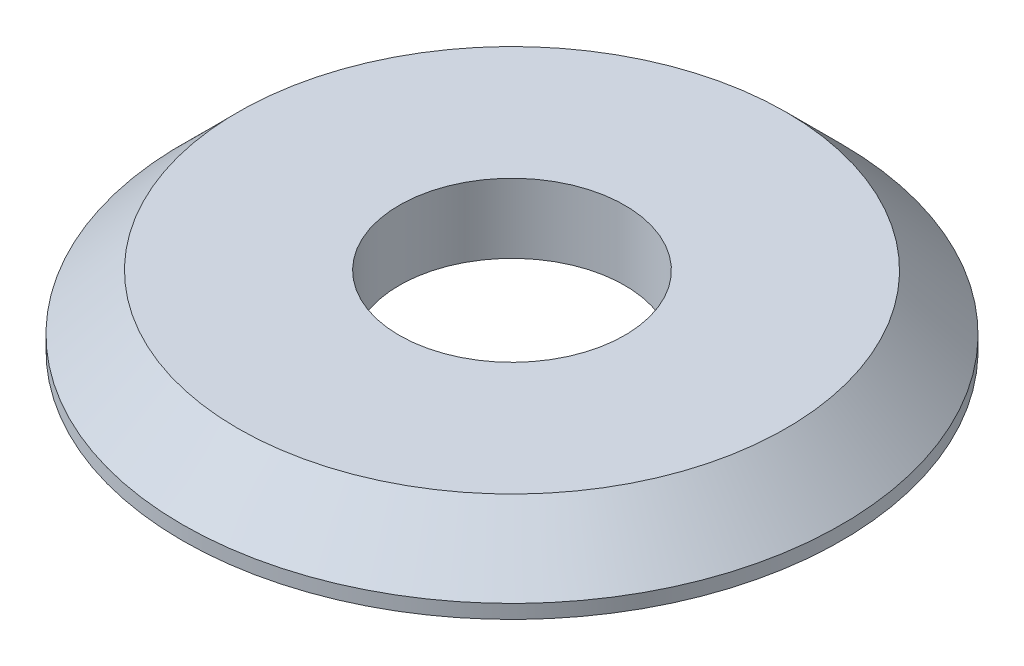
from build123d import *

# Parameters (mm, degrees)
SKIZZE1_R                       = 9.5
SKIZZE1_R_2                     = 3.25
AUFSATZ_LINEAR_AUSTRAGEN1_DEPTH = 2
FASE1_SIZE                      = 1.6


with BuildPart() as part:
    # Skizze1 → Aufsatz-Linear austragen1 (new body)
    with BuildSketch(Plane(origin=(0, 0, 0), x_dir=(1, 0, 0), z_dir=(0, 1, 0))):
        with Locations(Location((0, 0, 0), (0, 0, 270))):
            Circle(SKIZZE1_R)
        with Locations(Location((0, 0, 0), (0, 0, 270))):
            Circle(SKIZZE1_R_2, mode=Mode.SUBTRACT)
    extrude(amount=AUFSATZ_LINEAR_AUSTRAGEN1_DEPTH)

    # Fase1
    fase1_edges = [part.edges().sort_by_distance(p)[0] for p in [
        (0, 2, -9.5),
    ]]
    chamfer(fase1_edges, length=FASE1_SIZE)


solid = part.part
